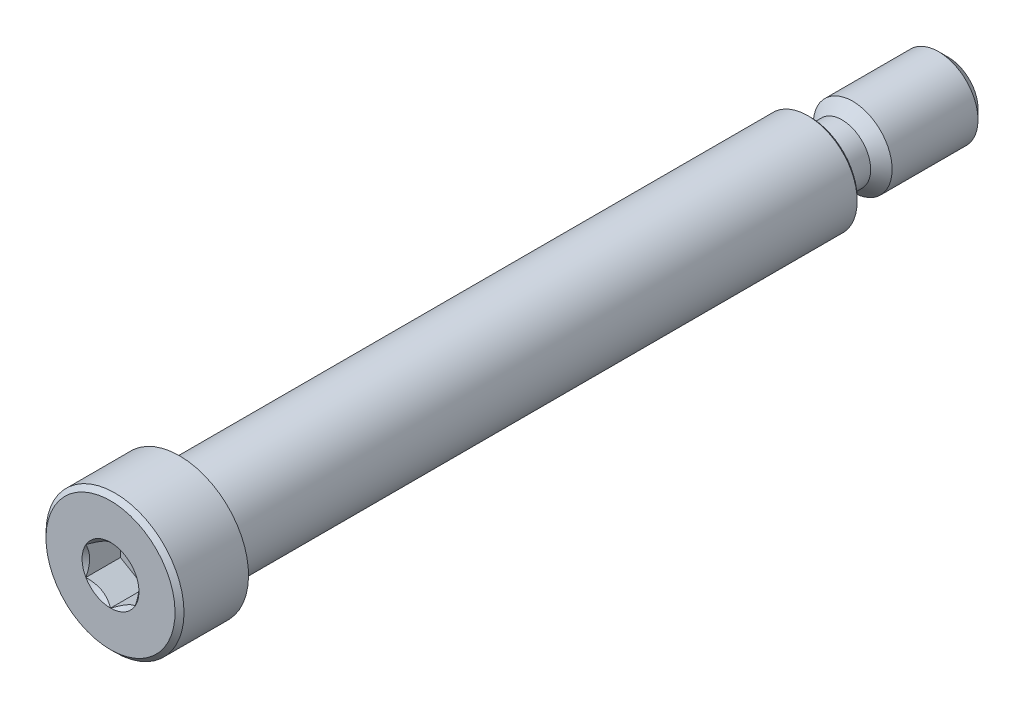
from build123d import *

# Parameters (mm, degrees)
CHAMFER1_SIZE      = 0.79375
CHAMFER2_SIZE      = 0.36115625
CHAMFER3_SIZE      = 0.2032
CUT_EXTRUDE2_DEPTH = 2.778125


with BuildPart() as part:
    # Sketch1 → Revolve1 (revolve)
    with BuildSketch(Plane(origin=(0, 0, 0), x_dir=(0, 0, -1), z_dir=(1, 0, 0))):
        Polygon((0, 5.55625), (5.55625, 5.55625), (5.55625, 3.96875), (56.35625, 3.96875), (56.35625, 3.175), (67.46875, 3.175), (67.46875, 0), (0, 0), align=None)
    revolve(axis=Axis((0, 0, -67.46875), (0, 0, 1)))

    # Sketch5 → Cut-Revolve1 (revolve, cut)
    with BuildSketch(Plane(origin=(0, 0, 0), x_dir=(0, 0, -1), z_dir=(1, 0, 0))):
        with BuildLine():
            Line((56.35625, 3.96875), (60.5536, 3.96875))
            Line((60.5536, 3.96875), (58.89625, 2.3114))
            Line((58.89625, 2.3114), (57.21985, 2.3114))
            ThreePointArc((57.21985, 2.3114), (56.609192584, 2.564342584), (56.35625, 3.175))
            Line((56.35625, 3.175), (56.35625, 3.96875))
        make_face()
    revolve(axis=Axis((0, 0, -67.46875), (0, 0, 1)), mode=Mode.SUBTRACT)

    # Chamfer1
    chamfer1_edges = [part.edges().sort_by_distance(p)[0] for p in [
        (0, -3.175, -67.46875),
    ]]
    chamfer(chamfer1_edges, length=CHAMFER1_SIZE)

    # Chamfer2
    chamfer2_edges = [part.edges().sort_by_distance(p)[0] for p in [
        (0, -5.55625, 0),
    ]]
    chamfer(chamfer2_edges, length=CHAMFER2_SIZE)

    # Chamfer3
    chamfer3_edges = [part.edges().sort_by_distance(p)[0] for p in [
        (0, -3.96875, -56.35625),
    ]]
    chamfer(chamfer3_edges, length=CHAMFER3_SIZE)

    # Sketch8 → Cut-Extrude2 (cut)
    with BuildSketch(Plane.XY):
        Polygon((1.984375, 1.14567944), (0, 2.291358881), (-1.984375, 1.14567944), (-1.984375, -1.14567944), (0, -2.291358881), (1.984375, -1.14567944), align=None)
    extrude(amount=-CUT_EXTRUDE2_DEPTH, mode=Mode.SUBTRACT)

    # Cut-Extrude4 cone 1 section (through the dimple's axis) → Cut-Extrude4 (revolve, cut)
    with BuildSketch(Plane(origin=(0, 0, 0), x_dir=(0, -1, 0), z_dir=(1, 0, 0))):
        Polygon((0, 0), (2.291358881, 0), (0, 2.291358881), align=None)
    revolve(axis=Axis((0, 0, 0), (0, 0, -1)), mode=Mode.SUBTRACT)


solid = part.part
